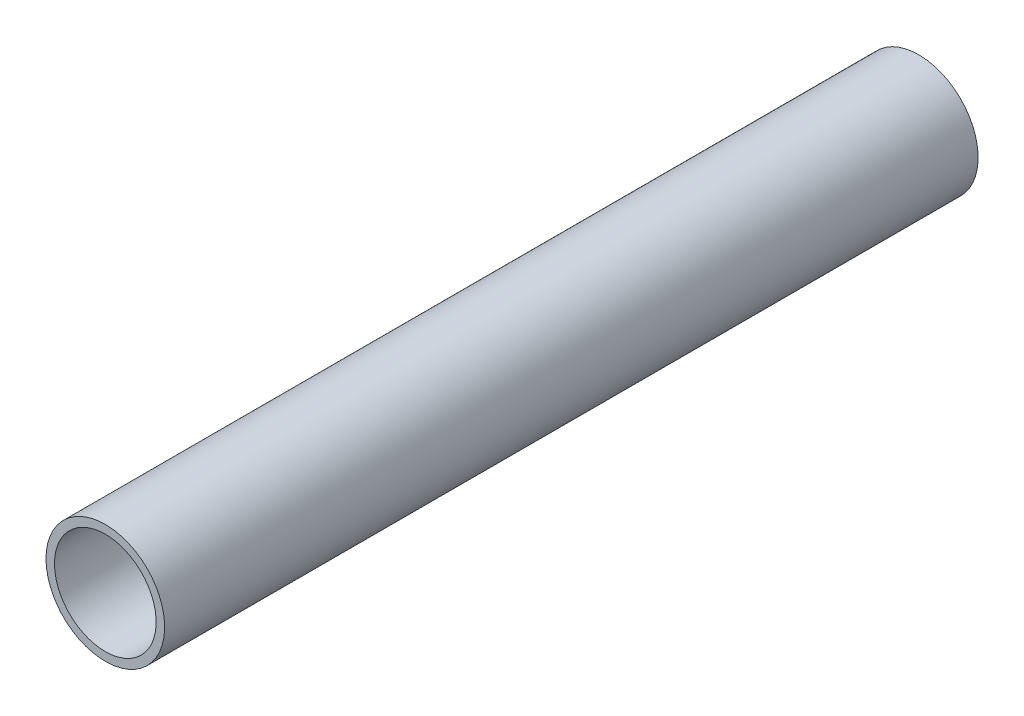
from build123d import *

# Parameters (mm, degrees)
SKETCH1_R           = 11.1125
SKETCH1_R_2         = 9.525
BOSS_EXTRUDE1_DEPTH = 76.2


with BuildPart() as part:
    # Sketch1 → Boss-Extrude1 (new, symmetric)
    with BuildSketch(Plane.XY):
        Circle(SKETCH1_R)
        Circle(SKETCH1_R_2, mode=Mode.SUBTRACT)
    extrude(amount=BOSS_EXTRUDE1_DEPTH, both=True)


solid = part.part
